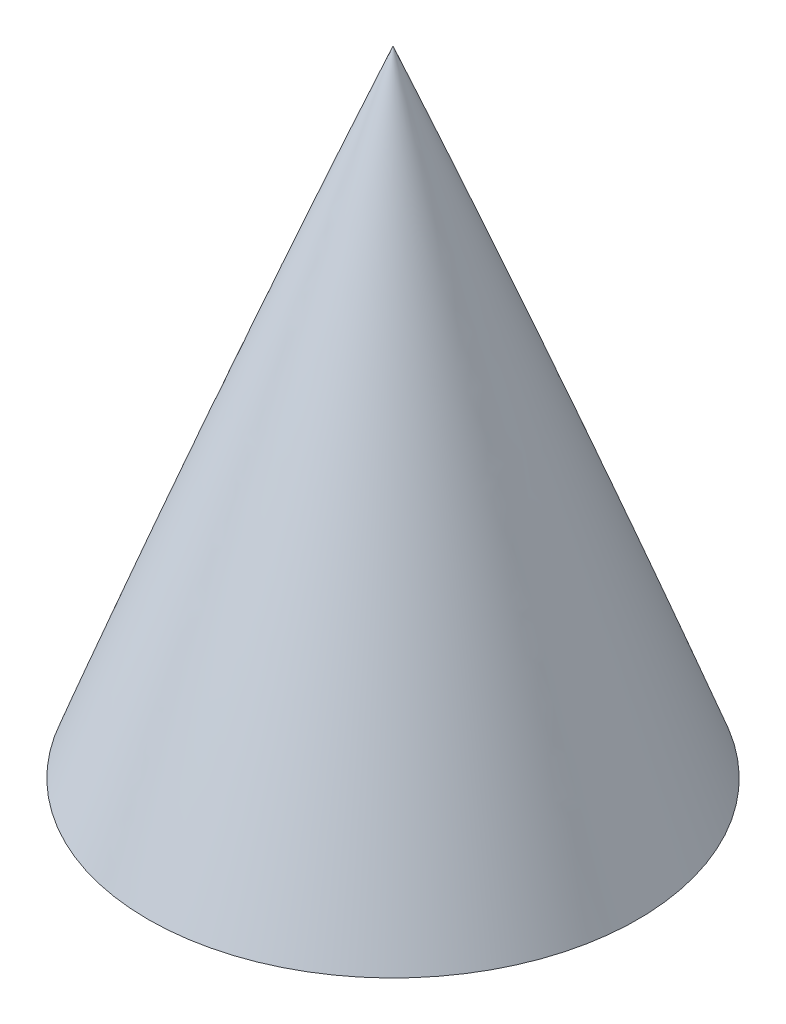
from build123d import *

# Parameters (mm, degrees)
BOSS_EXTRUDE1_DEPTH      = 10
BOSS_EXTRUDE1_DEPTH_BACK = 152.4
SKETCH2_R                = 76.2
SKETCH2_R_2              = 74.2
SKETCH6_R                = 147.183974893
CUT_EXTRUDE1_DEPTH       = 1000


with BuildPart() as part:
    # Sketch1 → Revolve3 (revolve)
    with BuildSketch(Plane.XY):
        with BuildLine():
            Line((0, 400), (0, 401.853426775))
            ThreePointArc((0, 401.853426775), (58.468341276, 204.695759977), (78.2, 0))
            Line((78.2, 0), (76.2, 0))
            ThreePointArc((76.2, 0), (56.977268898, 201.872568324), (0, 396.489212171))
            Line((0, 396.489212171), (0, 400))
        make_face()
    revolve(axis=Axis((0, 400, 0), (0, 1, 0)))

    # Sketch2 → Boss-Extrude1 (add, two sides: drawn at the far end of the back side and taken through both)
    with BuildSketch(Plane(origin=(0, 0, 0), x_dir=(1, 0, 0), z_dir=(0, 1, 0)).offset(-BOSS_EXTRUDE1_DEPTH_BACK)):
        with Locations(Location((0, 0, 0), (0, 0, 90))):
            Circle(SKETCH2_R)
        with Locations(Location((0, 0, 0), (0, 0, 270))):
            Circle(SKETCH2_R_2, mode=Mode.SUBTRACT)
    extrude(amount=BOSS_EXTRUDE1_DEPTH + BOSS_EXTRUDE1_DEPTH_BACK)

    # Sketch6 → Cut-Extrude1 (cut)
    with BuildSketch(Plane(origin=(0, 370, 0), x_dir=(-1, 0, 0), z_dir=(0, -1, 0))):
        Circle(SKETCH6_R)
    extrude(amount=CUT_EXTRUDE1_DEPTH, mode=Mode.SUBTRACT)


solid = part.part
